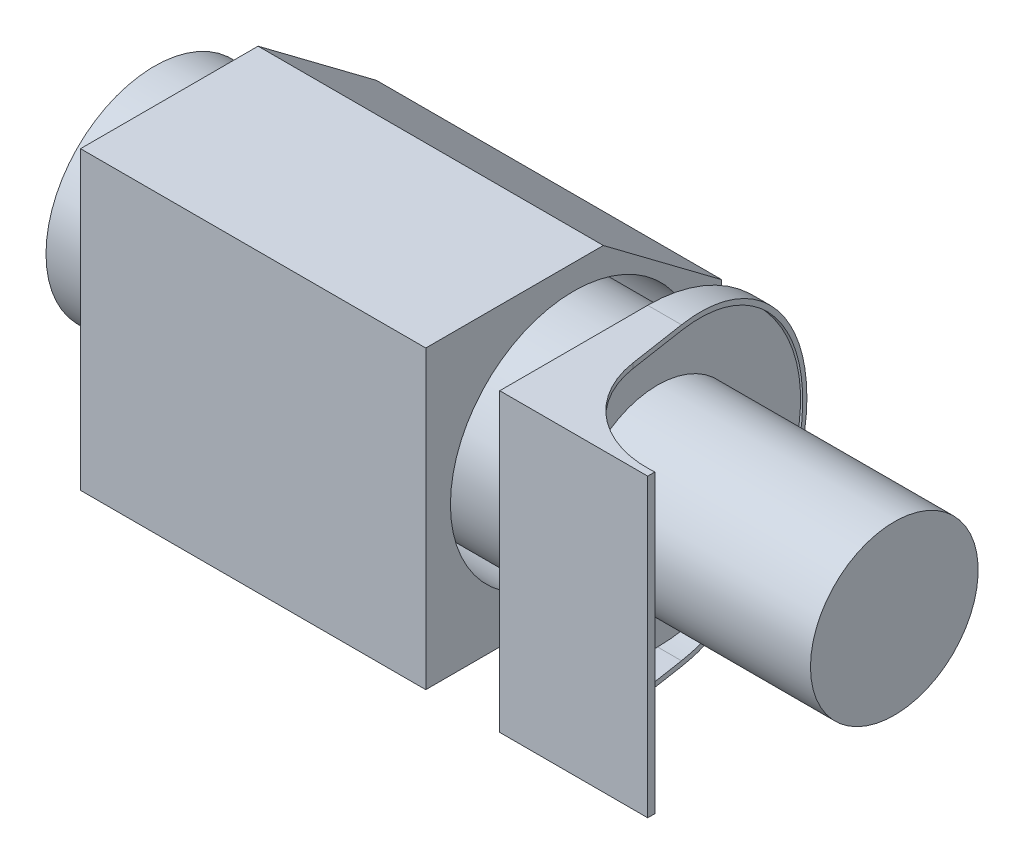
from build123d import *

# Parameters (mm, degrees)
SKETCH1_W           = 300
SKETCH1_H           = 600
BOSS_EXTRUDE1_DEPTH = 600
SKETCH3_OUTSIDE_W   = 782
SKETCH3_OUTSIDE_H   = 782
CUT_EXTRUDE1_DEPTH  = 901
CUT_EXTRUDE2_DEPTH  = 901
FILLET1_R           = 200
SKETCH5_R           = 220
BOSS_EXTRUDE2_DEPTH = 1000
SKETCH6_R           = 170
BOSS_EXTRUDE3_DEPTH = 500
CUT_EXTRUDE3_START  = -280
SKETCH7_R           = 170
CUT_EXTRUDE3_DEPTH  = 280
SKETCH8_R           = 250
BOSS_EXTRUDE4_DEPTH = 700


with BuildPart() as part:
    # Sketch1 → Boss-Extrude1 (new body)
    with BuildSketch(Plane(origin=(0, 0, 0), x_dir=(1, 0, 0), z_dir=(0, 1, 0))):
        with Locations((150, 300)):
            Rectangle(SKETCH1_W, SKETCH1_H)
    extrude(amount=BOSS_EXTRUDE1_DEPTH)

    # Sketch3 outside → Cut-Extrude1 (cut, through all)
    with BuildSketch(Plane.ZY):
        with Locations((-300, 300)):
            Rectangle(SKETCH3_OUTSIDE_W, SKETCH3_OUTSIDE_H)
        with BuildLine():
            Line((0, 600), (-300, 600))
            ThreePointArc((-300, 600), (-600, 300), (-300, 0))
            Line((-300, 0), (0, 0))
            Line((0, 0), (0, 600))
        make_face(mode=Mode.SUBTRACT)
    extrude(amount=-CUT_EXTRUDE1_DEPTH, mode=Mode.SUBTRACT)

    # Sketch4 → Cut-Extrude2 (cut, through all)
    with BuildSketch(Plane.XZ):
        with BuildLine():
            Line((97.914801383, -107.096121744), (22.782668077, -600))
            Line((22.782668077, -600), (300, -600))
            Line((300, -600), (300, -14.511559599))
            add(Edge.make_bspline(
                [(300, -14.511559599), (162.264361077, -6.054695984), (97.914801383, -107.096121744)],
                knots=[0, 0, 0, 1, 1, 1], degree=2))
        make_face()
    extrude(amount=-CUT_EXTRUDE2_DEPTH, mode=Mode.SUBTRACT)

    # Fillet1
    fillet1_edges = [part.edges().sort_by_distance(p)[0] for p in [
        (97.914801383, 300, -107.096121744),
    ]]
    fillet(fillet1_edges, radius=FILLET1_R)

    # Sketch5 → Boss-Extrude2 (add)
    with BuildSketch(Plane.ZY):
        with Locations((-300, 300)):
            Circle(SKETCH5_R)
    extrude(amount=BOSS_EXTRUDE2_DEPTH)

    # Sketch6 → Boss-Extrude3 (add)
    with BuildSketch(Plane.ZY):
        with Locations((-300, 300)):
            Circle(SKETCH6_R)
    extrude(amount=-BOSS_EXTRUDE3_DEPTH)

    # Sketch7 → Cut-Extrude3 (cut)
    with BuildSketch(Plane(origin=(300, 0, 0), x_dir=(0, 0, -1), z_dir=(1, 0, 0)).offset(CUT_EXTRUDE3_START)):
        with BuildLine():
            Line((300, 590), (14.511559599, 590))
            Line((14.511559599, 590), (14.511559599, 300))
            Line((14.511559599, 300), (14.511559599, 10))
            Line((14.511559599, 10), (300, 10))
            ThreePointArc((300, 10), (590, 300), (300, 590))
        make_face()
        with Locations(Location((300, 300, 0), (0, 0, 180))):
            Circle(SKETCH7_R, mode=Mode.SUBTRACT)
    extrude(amount=CUT_EXTRUDE3_DEPTH, mode=Mode.SUBTRACT)


with BuildPart() as body_2:
    # Sketch8 → Boss-Extrude4 (new body)
    with BuildSketch(Plane.ZY.offset(150)):
        Polygon((-360, 600), (-600, 420), (-600, 180), (-360, 0), (0, 0), (0, 600), align=None)
        with Locations((-300, 300)):
            Circle(SKETCH8_R, mode=Mode.SUBTRACT)
    extrude(amount=BOSS_EXTRUDE4_DEPTH)


solid = Compound([part.part, body_2.part])
